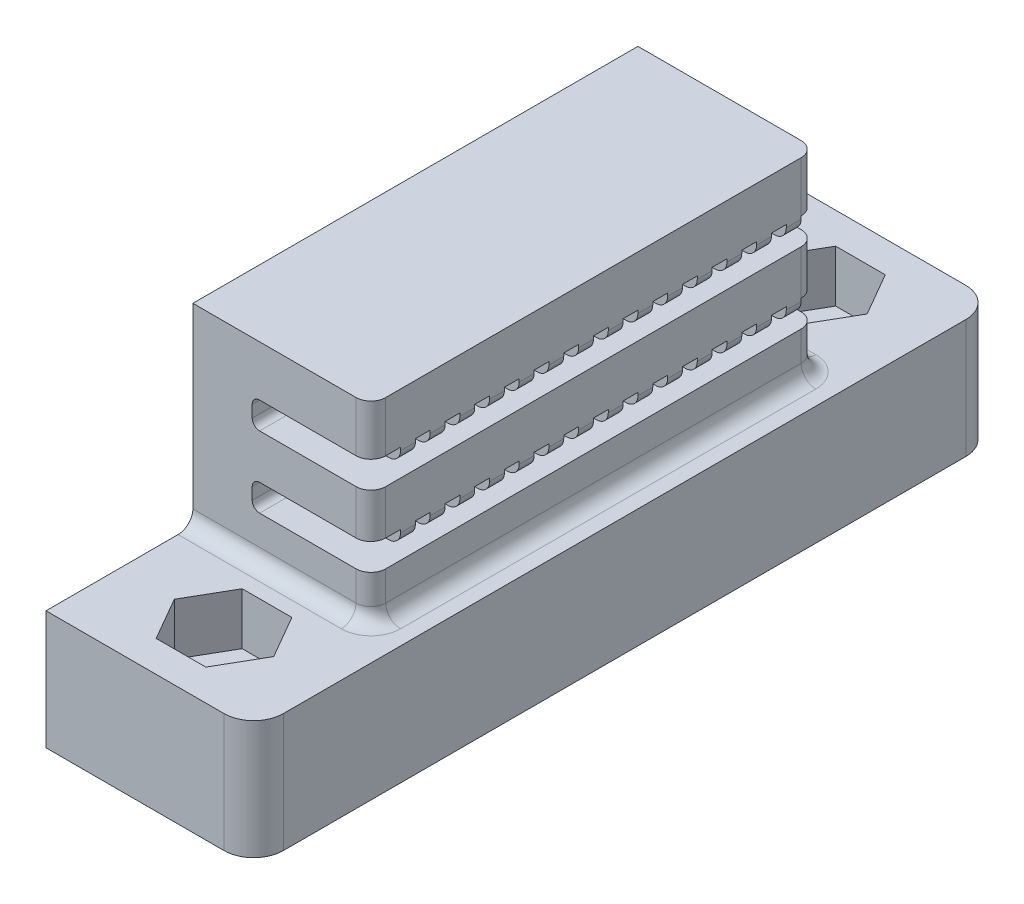
from build123d import *

# Parameters (mm, degrees)
CROQUIS1_W              = 14
CROQUIS1_H              = 50
CROQUIS1_R              = 1.55
SALIENTE_EXTRUIR1_DEPTH = 8
CORTAR_EXTRUIR1_DEPTH   = 3.5
CROQUIS3_W              = 14
CROQUIS3_H              = 30
SALIENTE_EXTRUIR3_DEPTH = 13
CORTAR_EXTRUIR2_DEPTH   = 10
CROQUIS5_W              = 30
CROQUIS5_H              = 13
CORTAR_EXTRUIR3_DEPTH   = 2
REDONDEO1_R             = 0.8
REDONDEO2_R             = 2
REDONDEO3_R             = 1
REDONDEO4_R             = 1
REDONDEO5_R             = 0.5


with BuildPart() as part:
    # Croquis1 → Saliente-Extruir1 (new body)
    with BuildSketch(Plane(origin=(0, 0, 0), x_dir=(1, 0, 0), z_dir=(0, 1, 0))):
        with Locations((7, 25)):
            Rectangle(CROQUIS1_W, CROQUIS1_H)
        with Locations(Location((7, 45, 0), (0, 0, 270))):
            Circle(CROQUIS1_R, mode=Mode.SUBTRACT)
        with Locations(Location((7, 5, 0), (0, 0, 90))):
            Circle(CROQUIS1_R, mode=Mode.SUBTRACT)
    extrude(amount=SALIENTE_EXTRUIR1_DEPTH)

    # Croquis2 → Cortar-Extruir1 (cut)
    with BuildSketch(Plane(origin=(0, 8, 0), x_dir=(1, 0, 0), z_dir=(0, 1, 0))):
        Polygon((10.348631561, 45), (8.674315781, 47.9), (5.325684219, 47.9), (3.651368439, 45), (5.325684219, 42.1), (8.674315781, 42.1), align=None)
        Polygon((10.348631561, 5), (8.674315781, 7.9), (5.325684219, 7.9), (3.651368439, 5), (5.325684219, 2.1), (8.674315781, 2.1), align=None)
    extrude(amount=-CORTAR_EXTRUIR1_DEPTH, mode=Mode.SUBTRACT)

    # Croquis3 → Saliente-Extruir3 (add)
    with BuildSketch(Plane(origin=(0, 8, 0), x_dir=(1, 0, 0), z_dir=(0, 1, 0))):
        with Locations((7, 24.9)):
            Rectangle(CROQUIS3_W, CROQUIS3_H)
    extrude(amount=SALIENTE_EXTRUIR3_DEPTH)

    # Croquis4 → Cortar-Extruir2 (cut)
    with BuildSketch(Plane(origin=(14, 0, 0), x_dir=(0, 0, -1), z_dir=(1, 0, 0))):
        Polygon((39.9, 17.6), (38.9, 17.6), (38.9, 16.6), (37.9, 16.6), (37.9, 17.6), (36.9, 17.6), (36.9, 16.6), (35.9, 16.6), (35.9, 17.6), (34.9, 17.6), (34.9, 16.6), (33.9, 16.6), (33.9, 17.6), (32.9, 17.6), (32.9, 16.6), (31.9, 16.6), (31.9, 17.6), (30.9, 17.6), (30.9, 16.6), (29.9, 16.6), (29.9, 17.6), (28.9, 17.6), (28.9, 16.6), (27.9, 16.6), (27.9, 17.6), (26.9, 17.6), (26.9, 16.6), (25.9, 16.6), (25.9, 17.6), (24.9, 17.6), (24.9, 16.6), (23.9, 16.6), (23.9, 17.6), (22.9, 17.6), (22.9, 16.6), (21.9, 16.6), (21.9, 17.6), (20.9, 17.6), (20.9, 16.6), (19.9, 16.6), (19.9, 17.6), (18.9, 17.6), (18.9, 16.6), (17.9, 16.6), (17.9, 17.6), (16.9, 17.6), (16.9, 16.6), (15.9, 16.6), (15.9, 17.6), (14.9, 17.6), (14.9, 16.6), (13.9, 16.6), (13.9, 17.6), (12.9, 17.6), (12.9, 16.6), (11.9, 16.6), (11.9, 17.6), (9.9, 17.6), (9.9, 15.8), (39.9, 15.8), align=None)
        Polygon((39.9, 12.8), (38.9, 12.8), (38.9, 11.8), (37.9, 11.8), (37.9, 12.8), (36.9, 12.8), (36.9, 11.8), (35.9, 11.8), (35.9, 12.8), (34.9, 12.8), (34.9, 11.8), (33.9, 11.8), (33.9, 12.8), (32.9, 12.8), (32.9, 11.8), (31.9, 11.8), (31.9, 12.8), (30.9, 12.8), (30.9, 11.8), (29.9, 11.8), (29.9, 12.8), (28.9, 12.8), (28.9, 11.8), (27.9, 11.8), (27.9, 12.8), (26.9, 12.8), (26.9, 11.8), (25.9, 11.8), (25.9, 12.8), (24.9, 12.8), (24.9, 11.8), (23.9, 11.8), (23.9, 12.8), (22.9, 12.8), (22.9, 11.8), (21.9, 11.8), (21.9, 12.8), (20.9, 12.8), (20.9, 11.8), (19.9, 11.8), (19.9, 12.8), (18.9, 12.8), (18.9, 11.8), (17.9, 11.8), (17.9, 12.8), (16.9, 12.8), (16.9, 11.8), (15.9, 11.8), (15.9, 12.8), (14.9, 12.8), (14.9, 11.8), (13.9, 11.8), (13.9, 12.8), (12.9, 12.8), (12.9, 11.8), (11.9, 11.8), (11.9, 12.8), (9.9, 12.8), (9.9, 11), (39.9, 11), align=None)
    extrude(amount=-CORTAR_EXTRUIR2_DEPTH, mode=Mode.SUBTRACT)

    # Croquis5 → Cortar-Extruir3 (cut)
    with BuildSketch(Plane(origin=(14, 0, 0), x_dir=(0, 0, -1), z_dir=(1, 0, 0))):
        with Locations((24.9, 14.5)):
            Rectangle(CROQUIS5_W, CROQUIS5_H)
    extrude(amount=-CORTAR_EXTRUIR3_DEPTH, mode=Mode.SUBTRACT)

    # Redondeo1
    redondeo1_edges = [part.edges().sort_by_distance(p)[0] for p in [
        (12, 11.8, -12.4),
        (12, 11.8, -14.4),
        (12, 11.8, -16.4),
        (12, 11.8, -18.4),
        (12, 11.8, -20.4),
        (12, 11.8, -22.4),
        (12, 11.8, -24.4),
        (12, 11.8, -26.4),
        (12, 11.8, -28.4),
        (12, 11.8, -30.4),
        (12, 11.8, -32.4),
        (12, 11.8, -34.4),
        (12, 11.8, -36.4),
        (12, 11.8, -38.4),
        (12, 16.6, -12.4),
        (12, 16.6, -14.4),
        (12, 16.6, -16.4),
        (12, 16.6, -18.4),
        (12, 16.6, -20.4),
        (12, 16.6, -22.4),
        (12, 16.6, -24.4),
        (12, 16.6, -26.4),
        (12, 16.6, -28.4),
        (12, 16.6, -30.4),
        (12, 16.6, -32.4),
        (12, 16.6, -34.4),
        (12, 16.6, -36.4),
        (12, 16.6, -38.4),
    ]]
    fillet(redondeo1_edges, radius=REDONDEO1_R)

    # Redondeo2
    redondeo2_edges = [part.edges().sort_by_distance(p)[0] for p in [
        (14, 4, -50),
        (14, 4, 0),
    ]]
    fillet(redondeo2_edges, radius=REDONDEO2_R)

    # Redondeo3
    redondeo3_edges = [part.edges().sort_by_distance(p)[0] for p in [
        (12, 9.5, -9.9),
        (12, 14.3, -9.9),
        (12, 19.3, -9.9),
        (12, 9.5, -39.9),
        (12, 14.3, -39.9),
        (12, 19.3, -39.9),
    ]]
    fillet(redondeo3_edges, radius=REDONDEO3_R)

    # Redondeo4
    redondeo4_edges = [part.edges().sort_by_distance(p)[0] for p in [
        (5.5, 8, -9.9),
        (5.5, 8, -39.9),
        (12, 8, -24.9),
        (11.707106781, 8, -39.607106781),
        (11.707106781, 8, -10.192893219),
    ]]
    fillet(redondeo4_edges, radius=REDONDEO4_R)

    # Redondeo5
    redondeo5_edges = [part.edges().sort_by_distance(p)[0] for p in [
        (4, 15.8, -24.9),
        (4, 17.6, -10.9),
        (4, 17.6, -13.4),
        (4, 17.6, -15.4),
        (4, 17.6, -17.4),
        (4, 17.6, -19.4),
        (4, 17.6, -21.4),
        (4, 17.6, -23.4),
        (4, 17.6, -25.4),
        (4, 17.6, -27.4),
        (4, 17.6, -29.4),
        (4, 17.6, -31.4),
        (4, 17.6, -33.4),
        (4, 17.6, -35.4),
        (4, 17.6, -37.4),
        (4, 17.6, -39.4),
        (4, 11, -24.9),
        (4, 12.8, -10.9),
        (4, 12.8, -13.4),
        (4, 12.8, -15.4),
        (4, 12.8, -17.4),
        (4, 12.8, -19.4),
        (4, 12.8, -21.4),
        (4, 12.8, -23.4),
        (4, 12.8, -25.4),
        (4, 12.8, -27.4),
        (4, 12.8, -29.4),
        (4, 12.8, -31.4),
        (4, 12.8, -33.4),
        (4, 12.8, -35.4),
        (4, 12.8, -37.4),
        (4, 12.8, -39.4),
    ]]
    fillet(redondeo5_edges, radius=REDONDEO5_R)


solid = part.part
